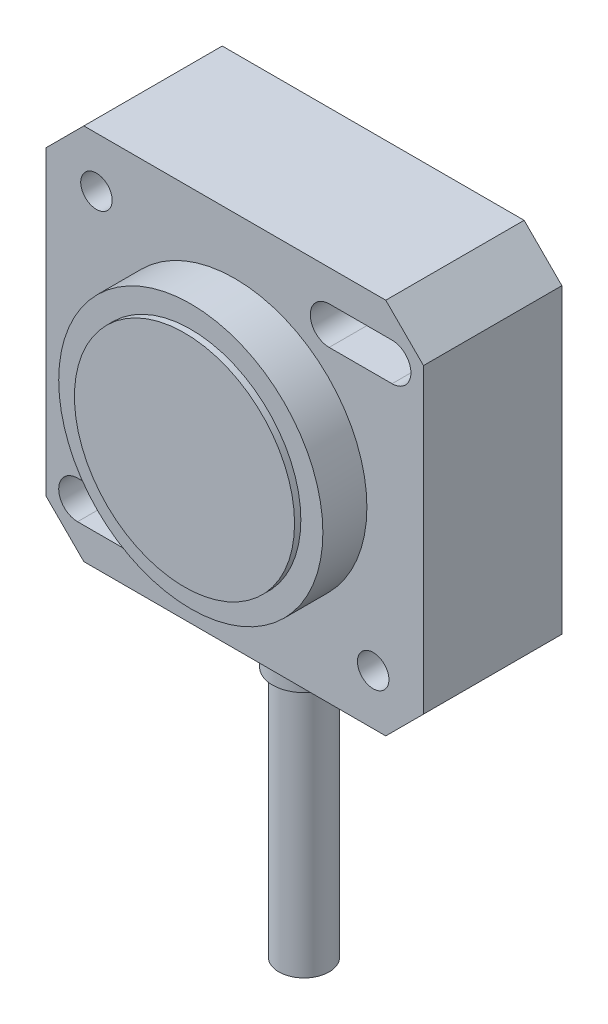
from build123d import *

# Parameters (mm, degrees)
ESQUISSE1_W             = 30
ESQUISSE1_H             = 30
BOSS_EXTRU_1_DEPTH      = 11
TROU_TARAUD_M31_D       = 2.5
ENL_V_MAT_EXTRU_1_REACH = 25.896
ESQUISSE6_R             = 10.5
BOSS_EXTRU_2_DEPTH      = 3.5
ESQUISSE7_R             = 8.75
BOSS_EXTRU_3_DEPTH      = 0.5
ESQUISSE8_R             = 2.5
BOSS_EXTRU_4_DEPTH      = 4
ESQUISSE9_R             = 2
BOSS_EXTRU_5_DEPTH      = 20
CHANFREIN1_SIZE         = 3
ENL_V_MAT_EXTRU_2_DEPTH = 3


with BuildPart() as part:
    # Esquisse1 → Boss.-Extru.1 (new body)
    with BuildSketch(Plane.XY):
        Rectangle(ESQUISSE1_W, ESQUISSE1_H)
    extrude(amount=BOSS_EXTRU_1_DEPTH)

    # Trou taraudé M31 (through all)
    with Locations(Plane.XY.offset(11)):
        with Locations((11, -11), (-11, 11)):
            Hole(TROU_TARAUD_M31_D / 2)

    # Esquisse5 → Enlèv. mat.-Extru.1 (cut, up to next)
    with BuildSketch(Plane.XY.offset(11), mode=Mode.PRIVATE) as enl_v_mat_extru_1_sk1:
        with BuildLine():
            Line((12.5, 12.5), (7.5, 12.5))
            ThreePointArc((7.5, 12.5), (6, 11), (7.5, 9.5))
            Line((7.5, 9.5), (12.5, 9.5))
            ThreePointArc((12.5, 9.5), (14, 11), (12.5, 12.5))
        make_face()
    enl_v_mat_extru_1_tool1 = extrude(enl_v_mat_extru_1_sk1.sketch, amount=-ENL_V_MAT_EXTRU_1_REACH, mode=Mode.PRIVATE) & part.part
    # Esquisse5 → Enlèv. mat.-Extru.1 (cut, up to next)
    with BuildSketch(Plane.XY.offset(11), mode=Mode.PRIVATE) as enl_v_mat_extru_1_sk2:
        with BuildLine():
            Line((-7.5, -9.5), (-12.5, -9.5))
            ThreePointArc((-12.5, -9.5), (-14, -11), (-12.5, -12.5))
            Line((-12.5, -12.5), (-7.5, -12.5))
            ThreePointArc((-7.5, -12.5), (-6, -11), (-7.5, -9.5))
        make_face()
    enl_v_mat_extru_1_tool2 = extrude(enl_v_mat_extru_1_sk2.sketch, amount=-ENL_V_MAT_EXTRU_1_REACH, mode=Mode.PRIVATE) & part.part
    add(enl_v_mat_extru_1_tool1.solids().sort_by_distance((10, 11, 11))[0], mode=Mode.SUBTRACT)
    add(enl_v_mat_extru_1_tool2.solids().sort_by_distance((-10, -11, 11))[0], mode=Mode.SUBTRACT)

    # Esquisse6 → Boss.-Extru.2 (add)
    with BuildSketch(Plane.XY.offset(11)):
        Circle(ESQUISSE6_R)
    extrude(amount=BOSS_EXTRU_2_DEPTH)

    # Esquisse7 → Boss.-Extru.3 (add)
    with BuildSketch(Plane.XY.offset(14.5)):
        Circle(ESQUISSE7_R)
    extrude(amount=BOSS_EXTRU_3_DEPTH)

    # Esquisse8 → Boss.-Extru.4 (add)
    with BuildSketch(Plane(origin=(0, -15, 0), x_dir=(-1, 0, 0), z_dir=(0, -1, 0))):
        with Locations(Location((0, -5.5, 0), (0, 0, 270))):
            Circle(ESQUISSE8_R)
    extrude(amount=BOSS_EXTRU_4_DEPTH)

    # Esquisse9 → Boss.-Extru.5 (add)
    with BuildSketch(Plane(origin=(0, -19, 0), x_dir=(-1, 0, 0), z_dir=(0, -1, 0))):
        with Locations(Location((0, -5.5, 0), (0, 0, 90))):
            Circle(ESQUISSE9_R)
    extrude(amount=BOSS_EXTRU_5_DEPTH)

    # Chanfrein1
    chanfrein1_edges = [part.edges().sort_by_distance(p)[0] for p in [
        (-15, 15, 5.5),
        (15, 15, 5.5),
        (15, -15, 5.5),
        (-15, -15, 5.5),
    ]]
    chamfer(chanfrein1_edges, length=CHANFREIN1_SIZE)

    # Esquisse10 → Enlèv. mat.-Extru.2 (cut)
    with BuildSketch(Plane(origin=(0, 0, 0), x_dir=(-1, 0, 0), z_dir=(0, 0, -1))):
        with BuildLine():
            Line((-7.5, 8), (-12.5, 8))
            Line((-12.5, 8), (-12.5, -7.964466094))
            Line((-12.5, -7.964466094), (-10.964466094, -7.964466094))
            ThreePointArc((-10.964466094, -7.964466094), (-8.843145751, -8.843145751), (-7.964466094, -10.964466094))
            Line((-7.964466094, -10.964466094), (-7.964466094, -12.5))
            Line((-7.964466094, -12.5), (4.5, -12.5))
            Line((4.5, -12.5), (4.5, -11))
            ThreePointArc((4.5, -11), (5.378679656, -8.878679656), (7.5, -8))
            Line((7.5, -8), (12.5, -8))
            Line((12.5, -8), (12.5, 8))
            Line((12.5, 8), (11, 8))
            ThreePointArc((11, 8), (8.878679656, 8.878679656), (8, 11))
            Line((8, 11), (8, 12.5))
            Line((8, 12.5), (-4.5, 12.5))
            Line((-4.5, 12.5), (-4.5, 11))
            ThreePointArc((-4.5, 11), (-5.378679656, 8.878679656), (-7.5, 8))
        make_face()
    extrude(amount=-ENL_V_MAT_EXTRU_2_DEPTH, mode=Mode.SUBTRACT)


solid = part.part
